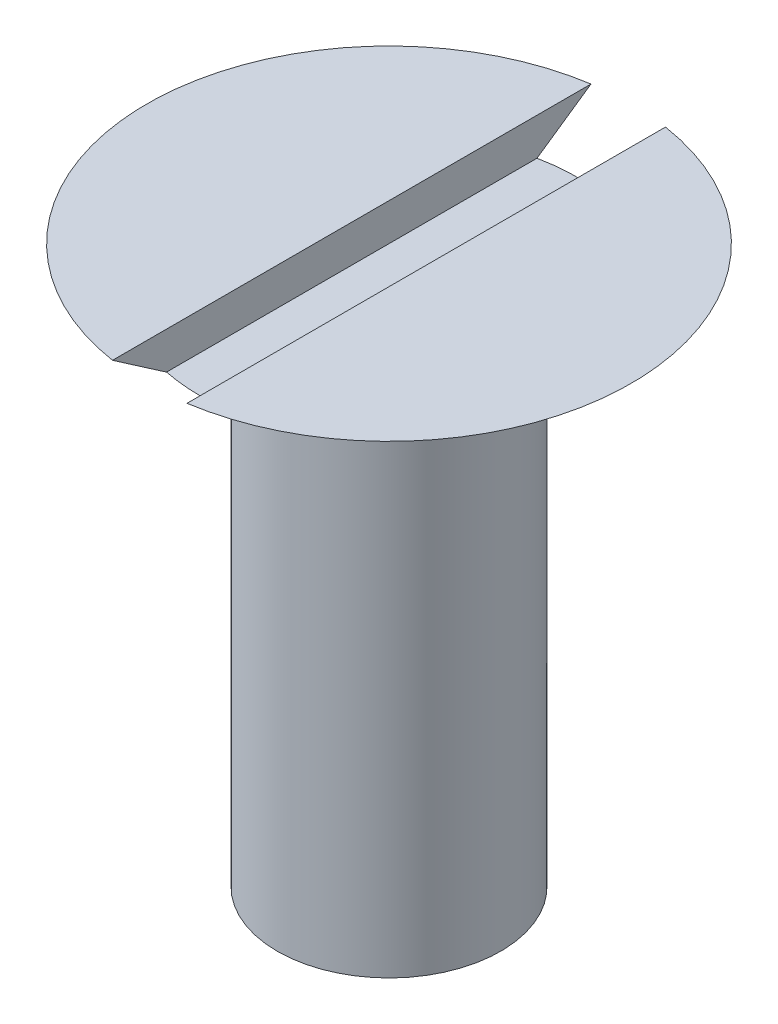
from build123d import *

# Parameters (mm, degrees)
CUT_EXTRUDE1_DEPTH      = 18.550618775
CUT_EXTRUDE1_DEPTH_BACK = 18.550618775
SKETCH1_4_W             = 2
SKETCH1_4_H             = 1


with BuildPart() as part:
    # Sketch1 → Revolve1 (revolve)
    with BuildSketch(Plane.XY):
        Polygon((0, -1.732050808), (3, 0), (3, 12.5), (6.5, 14.950726384), (0, 14.950726384), align=None)
    revolve(axis=Axis((0, 14.950726384, 0), (0, -1, 0)))

    # Sketch1<4> → Cut-Extrude1 (cut, two sides: drawn at the far end of the back side and taken through both)
    with BuildSketch(Plane.XY.offset(-CUT_EXTRUDE1_DEPTH_BACK)):
        with Locations((0, 14.450726384)):
            Rectangle(SKETCH1_4_W, SKETCH1_4_H)
    extrude(amount=CUT_EXTRUDE1_DEPTH + CUT_EXTRUDE1_DEPTH_BACK, mode=Mode.SUBTRACT)


solid = part.part
